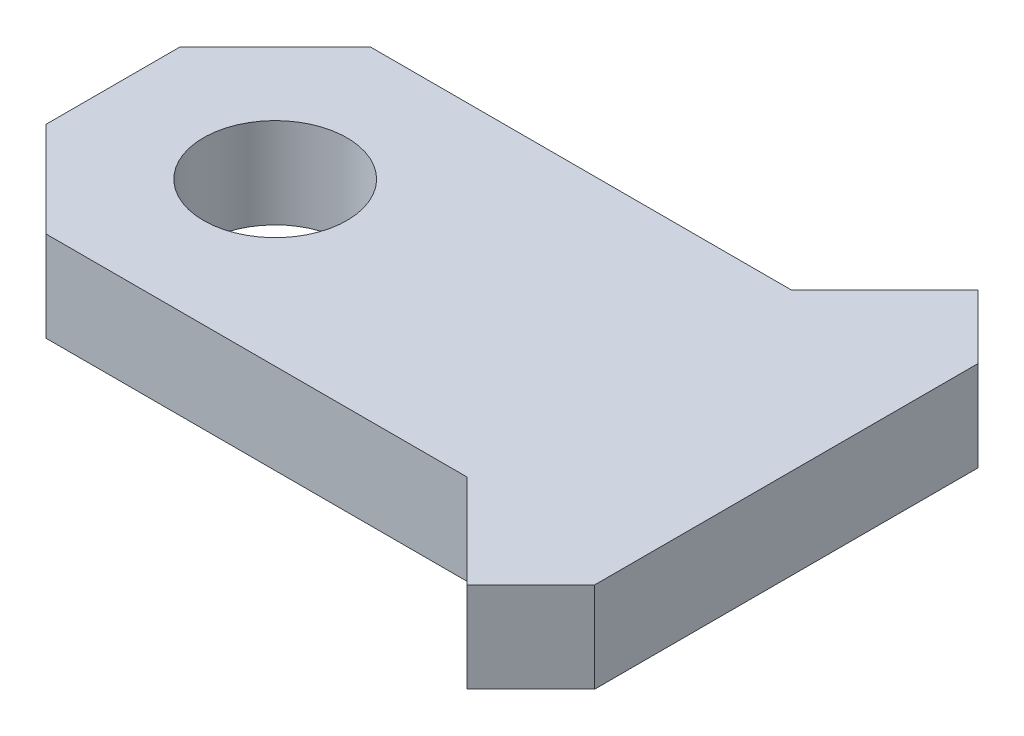
from build123d import *

# Parameters (mm, degrees)
SKETCH1_R           = 3.175
BOSS_EXTRUDE1_DEPTH = 4


with BuildPart() as part:
    # Sketch1 → Boss-Extrude1 (new body)
    with BuildSketch(Plane(origin=(0, 0, 0), x_dir=(1, 0, 0), z_dir=(0, 1, 0))):
        Polygon((-7.175, 2.97198231), (-7.175, -2.97198231), (-2.97198231, -7.175), (15.660281374, -7.175), (19.798989873, -11.313708499), (22.627416998, -8.485281374), (22.627416998, 8.485281374), (19.798989873, 11.313708499), (15.660281374, 7.175), (-2.97198231, 7.175), align=None)
        with Locations(Location((0, 0, 0), (0, 0, 270))):
            Circle(SKETCH1_R, mode=Mode.SUBTRACT)
    extrude(amount=BOSS_EXTRUDE1_DEPTH)


solid = part.part
